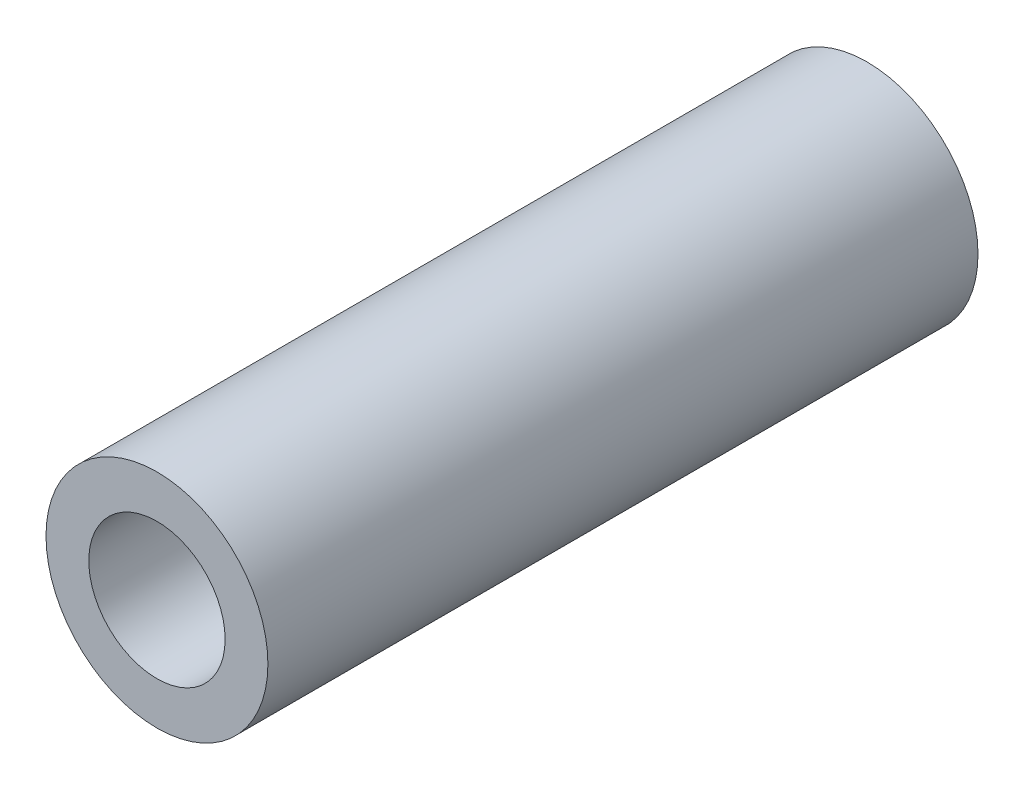
from build123d import *

# Parameters (mm, degrees)
SKETCH1_R      = 3.96875
SKETCH1_R_2    = 2.4384
EXTRUDE1_DEPTH = 12.7


with BuildPart() as part:
    # Sketch1 → Extrude1 (new, symmetric)
    with BuildSketch(Plane.XY):
        Circle(SKETCH1_R)
        Circle(SKETCH1_R_2, mode=Mode.SUBTRACT)
    extrude(amount=EXTRUDE1_DEPTH, both=True)


solid = part.part
